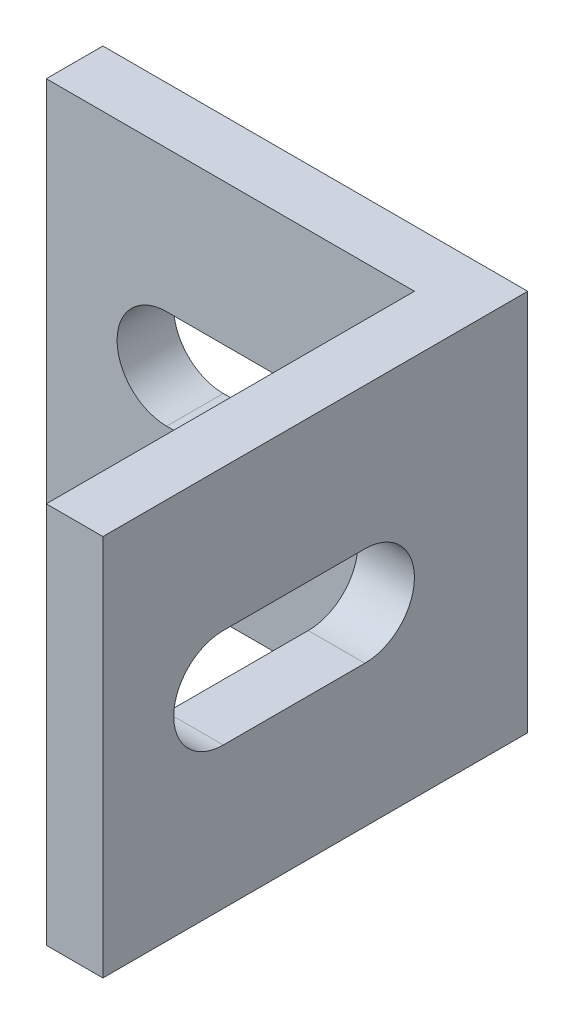
from build123d import *

# Parameters (mm, degrees)
SKETCH_1_W          = 30
SKETCH_1_H          = 27
EXTRUDE_1_DEPTH     = 4
SKETCH_2_W          = 4
SKETCH_2_H          = 27
EXTRUDE_2_DEPTH     = 26
CUT_EXTRUDE_1_DEPTH = 37


with BuildPart() as part:
    # 草图1 → 凸台-拉伸1 (new body)
    with BuildSketch(Plane.XY):
        with Locations((15, 13.5)):
            Rectangle(SKETCH_1_W, SKETCH_1_H)
        with BuildLine():
            Line((8.5, 17), (18.5, 17))
            ThreePointArc((18.5, 17), (22, 13.5), (18.5, 10))
            Line((18.5, 10), (8.5, 10))
            ThreePointArc((8.5, 10), (5, 13.5), (8.5, 17))
        make_face(mode=Mode.SUBTRACT)
    extrude(amount=EXTRUDE_1_DEPTH)

    # 草图2 → 凸台-拉伸2 (add)
    with BuildSketch(Plane.XY.offset(4)):
        with Locations((28, 13.5)):
            Rectangle(SKETCH_2_W, SKETCH_2_H)
    extrude(amount=EXTRUDE_2_DEPTH)

    # 草图3 → 切除-拉伸1 (cut)
    with BuildSketch(Plane.ZY.offset(-26)):
        with BuildLine():
            Line((21.5, 10), (11.5, 10))
            ThreePointArc((11.5, 10), (8, 13.5), (11.5, 17))
            Line((11.5, 17), (21.5, 17))
            ThreePointArc((21.5, 17), (25, 13.5), (21.5, 10))
        make_face()
    extrude(amount=-CUT_EXTRUDE_1_DEPTH, mode=Mode.SUBTRACT)


solid = part.part
